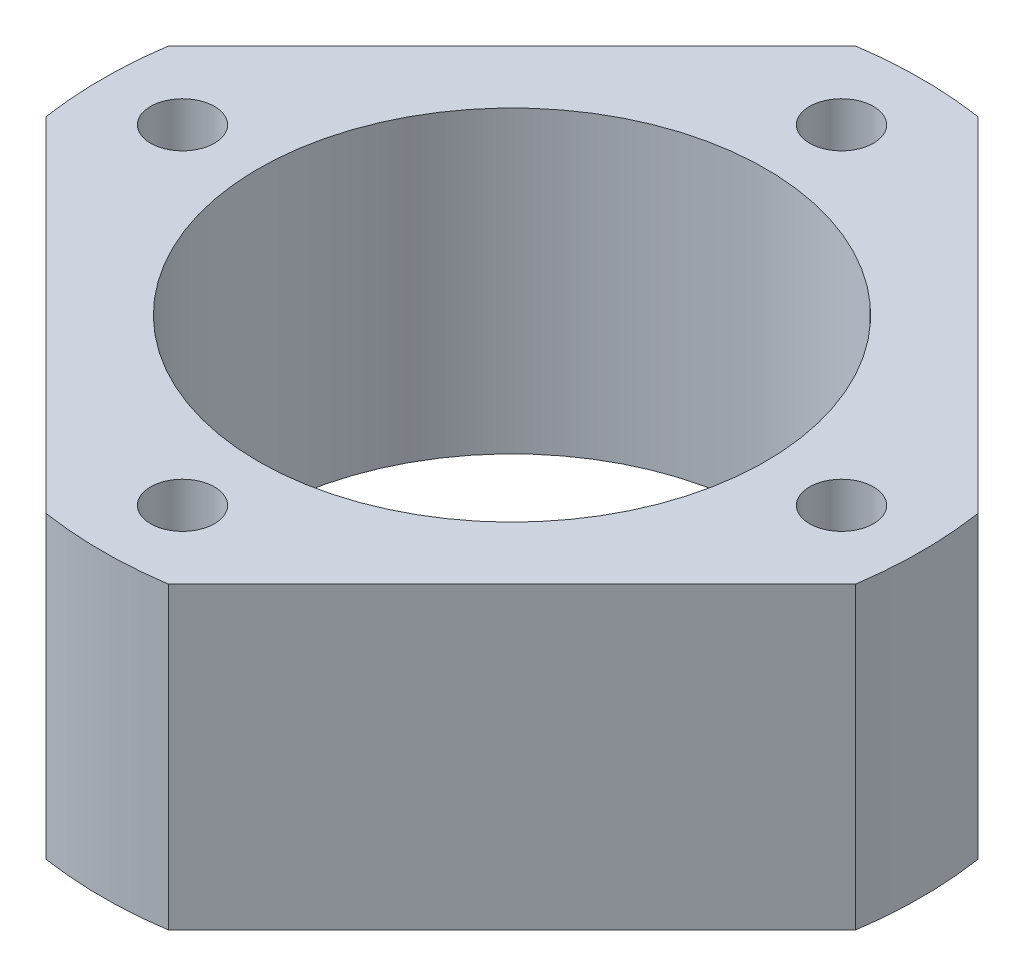
from build123d import *

# Parameters (mm, degrees)
SKETCH_1_R      = 1.6
SKETCH_1_R_2    = 12.7
EXTRUDE_1_DEPTH = 15


with BuildPart() as part:
    # 草图1 → 凸台-拉伸1 (new body)
    with BuildSketch(Plane(origin=(0, 0, 0), x_dir=(1, 0, 0), z_dir=(0, 1, 0))):
        with BuildLine():
            Line((-3.064936623, 20.269587157), (-20.269587157, 3.064936623))
            ThreePointArc((-20.269587157, 3.064936623), (-20.5, 0), (-20.269587157, -3.064936623))
            Line((-20.269587157, -3.064936623), (-3.064936623, -20.269587157))
            ThreePointArc((-3.064936623, -20.269587157), (0, -20.5), (3.064936623, -20.269587157))
            Line((3.064936623, -20.269587157), (20.269587157, -3.064936623))
            ThreePointArc((20.269587157, -3.064936623), (20.442315631, -1.536792649), (20.5, 0))
            ThreePointArc((20.5, 0), (20.442315631, 1.536792649), (20.269587157, 3.064936623))
            Line((20.269587157, 3.064936623), (3.064936623, 20.269587157))
            ThreePointArc((3.064936623, 20.269587157), (0, 20.5), (-3.064936623, 20.269587157))
        make_face()
        with Locations(Location((-16.5, 0, 0), (0, 0, 270))):
            Circle(SKETCH_1_R, mode=Mode.SUBTRACT)
        with Locations(Location((0, -16.5, 0), (0, 0, 270))):
            Circle(SKETCH_1_R, mode=Mode.SUBTRACT)
        with Locations(Location((0, 0, 0), (0, 0, 270))):
            Circle(SKETCH_1_R_2, mode=Mode.SUBTRACT)
        with Locations(Location((16.5, 0, 0), (0, 0, 270))):
            Circle(SKETCH_1_R, mode=Mode.SUBTRACT)
        with Locations(Location((0, 16.5, 0), (0, 0, 270))):
            Circle(SKETCH_1_R, mode=Mode.SUBTRACT)
    extrude(amount=EXTRUDE_1_DEPTH)


solid = part.part
